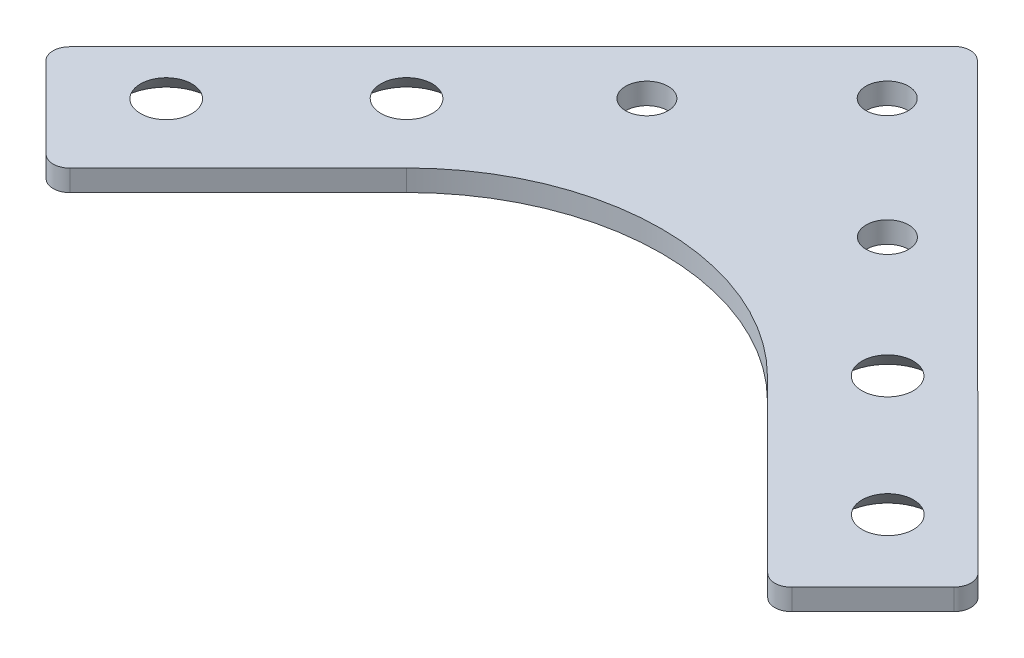
from build123d import *

# Parameters (mm, degrees)
BOSS_EXTRUDE1_DEPTH                  = 3.175
F_1_4_0_25_DIAMETER_HOLE1_D          = 6.35
F_1_4_0_25_DIAMETER_HOLE3_AT_2_COUNT = 2
F_1_4_0_25_DIAMETER_HOLE3_AT_2_PITCH = 25.4
F_1_4_0_25_DIAMETER_HOLE3_AT_3_COUNT = 2
F_1_4_0_25_DIAMETER_HOLE3_AT_3_PITCH = 71.842048969
F_1_4_0_25_DIAMETER_HOLE3_AT_4_COUNT = 2
F_1_4_0_25_DIAMETER_HOLE3_AT_4_PITCH = 91.581002397


with BuildPart() as part:
    # Outline → Boss-Extrude1 (new body)
    with BuildSketch(Plane.XZ.offset(-43.833362877)):
        with BuildLine():
            Line((176.972439461, -654.113339272), (243.430903053, -587.760058499))
            ThreePointArc((243.430903053, -587.760058499), (244.176274012, -585.964597022), (243.433747886, -584.167957177))
            Line((243.433747886, -584.167957177), (231.320007239, -572.035013901))
            ThreePointArc((231.320007239, -572.035013901), (229.524545763, -571.289642942), (227.727905917, -572.032169067))
            Line((227.727905917, -572.032169067), (202.161954847, -597.557657288))
            ThreePointArc((202.161954847, -597.557657288), (175.212357167, -608.695549172), (148.280435018, -597.514984781))
            Line((148.280435018, -597.514984781), (123.155639602, -572.350361691))
            ThreePointArc((123.155639602, -572.350361691), (121.360178125, -571.604990731), (119.56353828, -572.347516857))
            Line((119.56353828, -572.347516857), (107.430595004, -584.461257504))
            ThreePointArc((107.430595004, -584.461257504), (106.685224045, -586.256718981), (107.42775017, -588.053358826))
            Line((107.42775017, -588.053358826), (173.380338139, -654.110494438))
            ThreePointArc((173.380338139, -654.110494438), (175.175799616, -654.855865397), (176.972439461, -654.113339272))
        make_face()
    extrude(amount=BOSS_EXTRUDE1_DEPTH)

    # 1/4 (0.25) Diameter Hole1 (through all)
    with Locations(Plane(origin=(0, 40.658362877, 0), x_dir=(-1, 0, 0), z_dir=(0, -1, 0))):
        with Locations((-175.18563451, 642.437587559), (-193.160365289, 624.491305118), (-157.239352069, 624.46285678)):
            Hole(F_1_4_0_25_DIAMETER_HOLE1_D / 2)

    # Sketch11 → 1/4 (0.25) Diameter Hole3 (revolve, cut)
    with BuildSketch(Plane(origin=(139.293069629, 40.658362877, -606.488126001), x_dir=(0, 0, -1), z_dir=(1, 0, 0))):
        Polygon((0, 0), (0, 3.175), (3.175, 3.175), (3.175, 3.944613268), (6.604, 0), align=None)
    f_1_4_0_25_diameter_hole3 = revolve(axis=Axis((139.293069629, 34.308362877, -606.488126001), (0, 1, 0)), mode=Mode.SUBTRACT)

    # 1/4 (0.25) Diameter Hole3 at 2: 1/4 (0.25) Diameter Hole3 ×2
    with Locations(*[Vector(-0.7065465527738991, 0, 0.7076665660912065) * (i * F_1_4_0_25_DIAMETER_HOLE3_AT_2_PITCH) for i in range(1, F_1_4_0_25_DIAMETER_HOLE3_AT_2_COUNT)]):
        add(f_1_4_0_25_diameter_hole3, mode=Mode.SUBTRACT)

    # 1/4 (0.25) Diameter Hole3 at 3: 1/4 (0.25) Diameter Hole3 ×2
    with Locations(*[Vector(0.9999996863924931, 0, -0.0007919690116880901) * (i * F_1_4_0_25_DIAMETER_HOLE3_AT_3_PITCH) for i in range(1, F_1_4_0_25_DIAMETER_HOLE3_AT_3_COUNT)]):
        add(f_1_4_0_25_diameter_hole3, mode=Mode.SUBTRACT)

    # 1/4 (0.25) Diameter Hole3 at 4: 1/4 (0.25) Diameter Hole3 ×2
    with Locations(*[Vector(0.980735686075181, 0, 0.1953394841260828) * (i * F_1_4_0_25_DIAMETER_HOLE3_AT_4_PITCH) for i in range(1, F_1_4_0_25_DIAMETER_HOLE3_AT_4_COUNT)]):
        add(f_1_4_0_25_diameter_hole3, mode=Mode.SUBTRACT)


solid = part.part
